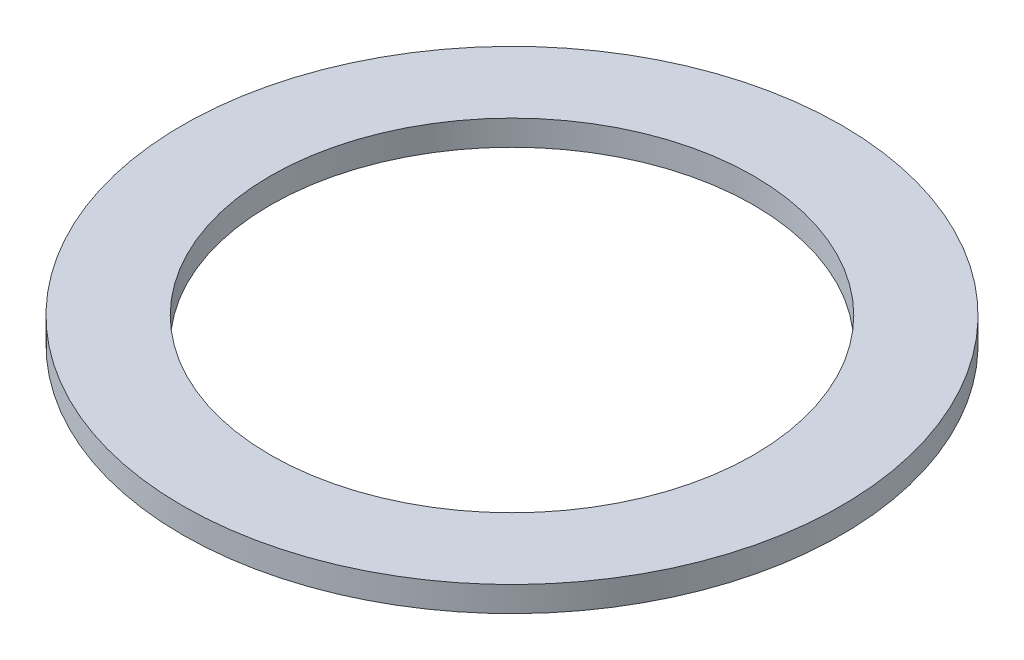
from build123d import *

# Parameters (mm, degrees)
SKETCH2_R           = 37.5
SKETCH2_R_2         = 27.5
BOSS_EXTRUDE1_DEPTH = 2.87


with BuildPart() as part:
    # Sketch2 → Boss-Extrude1 (new body)
    with BuildSketch(Plane(origin=(0, 0, 0), x_dir=(1, 0, 0), z_dir=(0, 1, 0))):
        with Locations(Location((0, 0, 0), (0, 0, 270))):
            Circle(SKETCH2_R)
        with Locations(Location((0, 0, 0), (0, 0, 270))):
            Circle(SKETCH2_R_2, mode=Mode.SUBTRACT)
    extrude(amount=BOSS_EXTRUDE1_DEPTH)


solid = part.part
